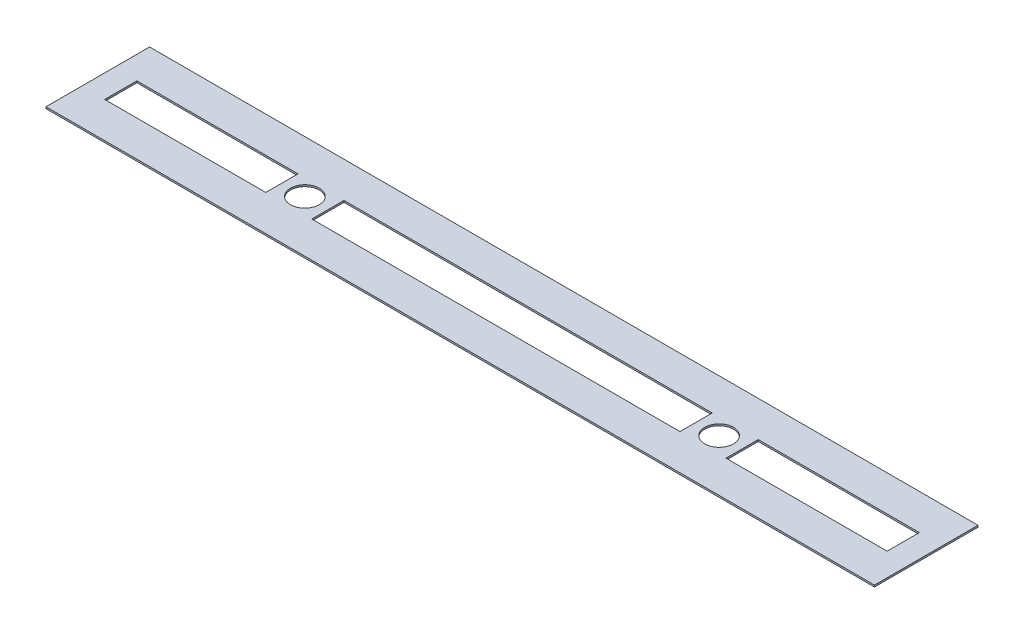
from build123d import *

# Parameters (mm, degrees)
SKETCH1_W           = 72
SKETCH1_H           = 9
SKETCH1_R           = 1.25
SKETCH1_W_2         = 14
SKETCH1_H_2         = 2.8
SKETCH1_W_3         = 32
BOSS_EXTRUDE1_DEPTH = 0.15


with BuildPart() as part:
    # Sketch1 → Boss-Extrude1 (new body)
    with BuildSketch(Plane(origin=(0, 0, 0), x_dir=(1, 0, 0), z_dir=(0, 1, 0))):
        Rectangle(SKETCH1_W, SKETCH1_H)
        with Locations(Location((-18, 0, 0), (0, 0, 270))):
            Circle(SKETCH1_R, mode=Mode.SUBTRACT)
        with Locations(Location((18, 0, 0), (0, 0, 270))):
            Circle(SKETCH1_R, mode=Mode.SUBTRACT)
        with Locations((27, 0)):
            Rectangle(SKETCH1_W_2, SKETCH1_H_2, mode=Mode.SUBTRACT)
        Rectangle(SKETCH1_W_3, SKETCH1_H_2, mode=Mode.SUBTRACT)
        with Locations((-27, 0)):
            Rectangle(SKETCH1_W_2, SKETCH1_H_2, mode=Mode.SUBTRACT)
    extrude(amount=BOSS_EXTRUDE1_DEPTH)


solid = part.part
